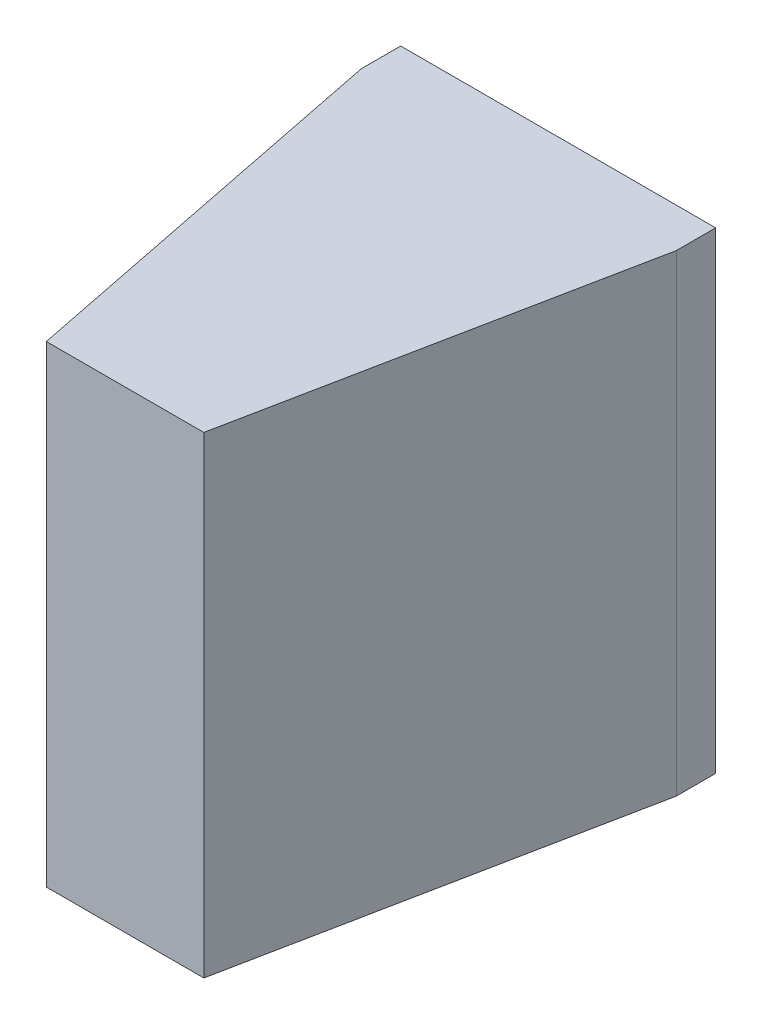
from build123d import *

# Parameters (mm, degrees)
SKETCH1_W           = 80
SKETCH1_H           = 120
BOSS_EXTRUDE1_DEPTH = 10
BOSS_EXTRUDE2_DEPTH = 60


with BuildPart() as part:
    # Sketch1 → Boss-Extrude1 (new body)
    with BuildSketch(Plane.XY):
        Rectangle(SKETCH1_W, SKETCH1_H)
    extrude(amount=BOSS_EXTRUDE1_DEPTH)

    # Sketch2 → Boss-Extrude2 (add, symmetric)
    with BuildSketch(Plane(origin=(0, 0, 0), x_dir=(1, 0, 0), z_dir=(0, 1, 0))):
        Polygon((40, -10), (-40, -10), (-20, -110), (20, -110), align=None)
    extrude(amount=BOSS_EXTRUDE2_DEPTH, both=True)


solid = part.part
